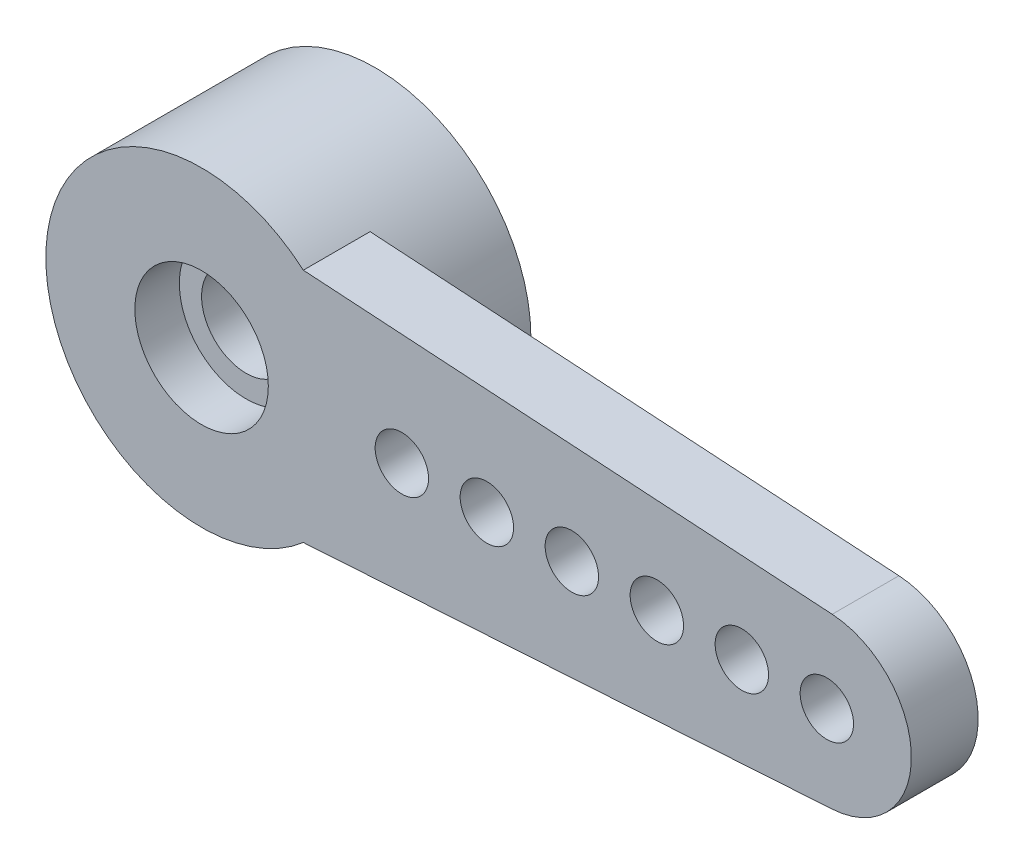
from build123d import *

# Parameters (mm, degrees)
SKETCH_1_R          = 3.5
EXTRUDE_1_DEPTH     = 3.9
EXTRUDE_START       = 2.4
SKETCH_1_6_R        = 0.6
EXTRUDE_2_DEPTH     = 1.5
SKETCH_1_3_R        = 2.5
CUT_EXTRUDE_1_DEPTH = 2
CUT_EXTRUDE_START   = 3.9
SKETCH_1_4_R        = 1.5
CUT_EXTRUDE_2_DEPTH = 1
SKETCH_1_5_R        = 1
CUT_EXTRUDE_3_DEPTH = 17.788761122


with BuildPart() as part:
    # 草图1 → 凸台-拉伸1 (new body)
    with BuildSketch(Plane.XY):
        Circle(SKETCH_1_R)
    extrude(amount=EXTRUDE_1_DEPTH)

    # 草图1<6> → 凸台-拉伸2 (add)
    with BuildSketch(Plane.XY.offset(EXTRUDE_START)):
        with BuildLine():
            Line((14.170277633, 1.89618915), (2.286372673, 2.65))
            ThreePointArc((2.286372673, 2.65), (3.5, 0), (2.286372673, -2.65))
            Line((2.286372673, -2.65), (14.170277633, -1.89618915))
            ThreePointArc((14.170277633, -1.89618915), (15.95, 0), (14.170277633, 1.89618915))
        make_face()
        with BuildLine():
            ThreePointArc((11.54, 0), (12.14, 0.6), (12.74, 0))
            ThreePointArc((12.74, 0), (12.14, -0.6), (11.54, 0))
        make_face(mode=Mode.SUBTRACT)
        with Locations((4.5, 0)):
            Circle(SKETCH_1_6_R, mode=Mode.SUBTRACT)
        with BuildLine():
            ThreePointArc((5.81, 0), (6.41, 0.6), (7.01, 0))
            ThreePointArc((7.01, 0), (6.41, -0.6), (5.81, 0))
        make_face(mode=Mode.SUBTRACT)
        with BuildLine():
            ThreePointArc((7.72, 0), (8.32, 0.6), (8.92, 0))
            ThreePointArc((8.92, 0), (8.32, -0.6), (7.72, 0))
        make_face(mode=Mode.SUBTRACT)
        with BuildLine():
            ThreePointArc((9.63, 0), (10.23, 0.6), (10.83, 0))
            ThreePointArc((10.83, 0), (10.23, -0.6), (9.63, 0))
        make_face(mode=Mode.SUBTRACT)
        with Locations((14.05, 0)):
            Circle(SKETCH_1_6_R, mode=Mode.SUBTRACT)
    extrude(amount=EXTRUDE_2_DEPTH)

    # 草图1<3> → 切除-拉伸1 (cut)
    with BuildSketch(Plane.XY):
        Circle(SKETCH_1_3_R)
    extrude(amount=CUT_EXTRUDE_1_DEPTH, mode=Mode.SUBTRACT)

    # 草图1<4> → 切除-拉伸2 (cut)
    with BuildSketch(Plane.XY.offset(CUT_EXTRUDE_START)):
        Circle(SKETCH_1_4_R)
    extrude(amount=-CUT_EXTRUDE_2_DEPTH, mode=Mode.SUBTRACT)

    # 草图1<5> → 切除-拉伸3 (cut, through all)
    with BuildSketch(Plane.XY):
        Circle(SKETCH_1_5_R)
    extrude(amount=CUT_EXTRUDE_3_DEPTH, mode=Mode.SUBTRACT)


solid = part.part
